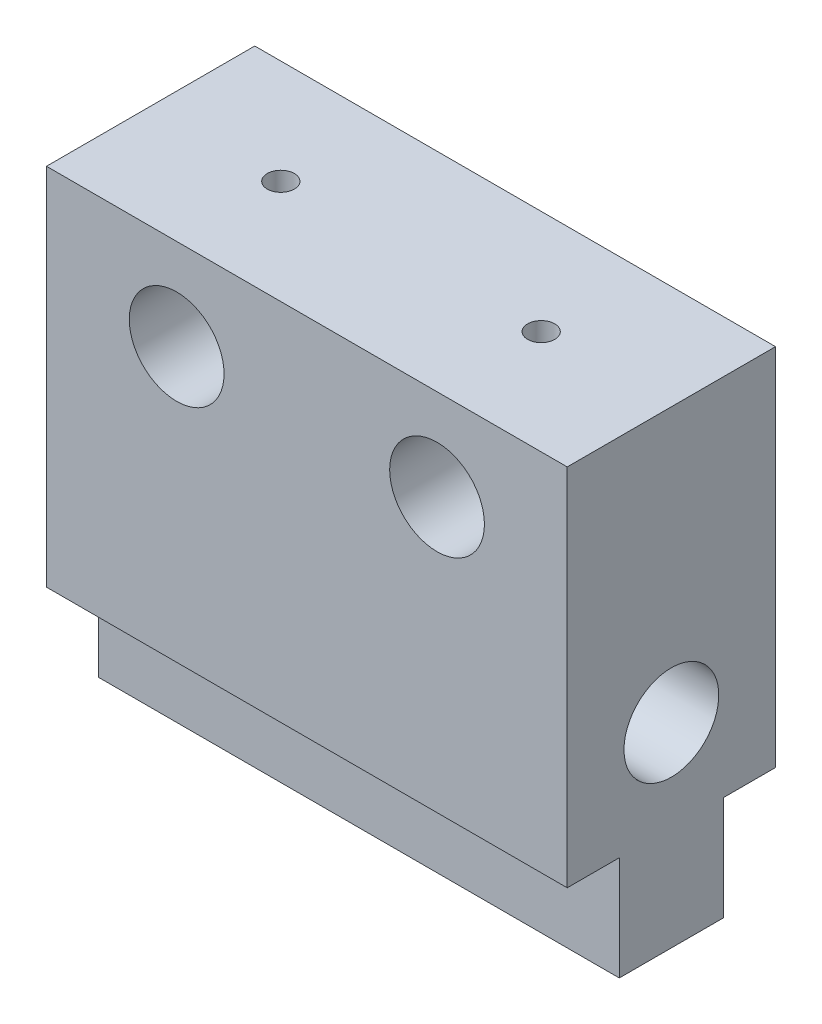
from build123d import *

# Parameters (mm, degrees)
SKETCH1_W               = 100
SKETCH1_H               = 70
BOSS_EXTRUDE1_DEPTH     = 20
CUT_EXTRUDE1_DEPTH      = 73.972597597
CUT_EXTRUDE1_DEPTH_BACK = 73.972597597
SKETCH2_R               = 9.1
CUT_EXTRUDE2_DEPTH      = 108.819293264
CUT_EXTRUDE2_DEPTH_BACK = 108.819293264
SKETCH3_R               = 9.1
SKETCH4_R               = 2.6
CUT_EXTRUDE4_DEPTH      = 20
SKETCH5_W               = 100
SKETCH5_H               = 20
BOSS_EXTRUDE2_DEPTH     = 20


with BuildPart() as part:
    # Sketch1 → Boss-Extrude1 (new, symmetric)
    with BuildSketch(Plane.XY):
        Rectangle(SKETCH1_W, SKETCH1_H)
    extrude(amount=BOSS_EXTRUDE1_DEPTH, both=True)

    # Sketch2 → Cut-Extrude1 (cut, two sides: drawn at the far end of the back side and taken through both)
    with BuildSketch(Plane.XY.offset(20).offset(-CUT_EXTRUDE1_DEPTH_BACK)):
        with Locations((25, 17.5)):
            Circle(SKETCH2_R)
        with Locations((-25, 17.5)):
            Circle(SKETCH2_R)
    extrude(amount=CUT_EXTRUDE1_DEPTH + CUT_EXTRUDE1_DEPTH_BACK, mode=Mode.SUBTRACT)

    # Sketch3 → Cut-Extrude2 (cut, two sides: drawn at the far end of the back side and taken through both)
    with BuildSketch(Plane.ZY.offset(50).offset(-CUT_EXTRUDE2_DEPTH_BACK)):
        with Locations((0, -17.5)):
            Circle(SKETCH3_R)
    extrude(amount=CUT_EXTRUDE2_DEPTH + CUT_EXTRUDE2_DEPTH_BACK, mode=Mode.SUBTRACT)

    # Sketch4 → Cut-Extrude4 (cut)
    with BuildSketch(Plane(origin=(0, 35, 0), x_dir=(1, 0, 0), z_dir=(0, 1, 0))):
        with Locations(Location((-25, 0, 0), (0, 0, 270))):
            Circle(SKETCH4_R)
        with Locations(Location((25, 0, 0), (0, 0, 270))):
            Circle(SKETCH4_R)
    extrude(amount=-CUT_EXTRUDE4_DEPTH, mode=Mode.SUBTRACT)

    # Sketch5 → Boss-Extrude2 (add)
    with BuildSketch(Plane.XZ.offset(35)):
        Rectangle(SKETCH5_W, SKETCH5_H)
    extrude(amount=BOSS_EXTRUDE2_DEPTH)


solid = part.part
